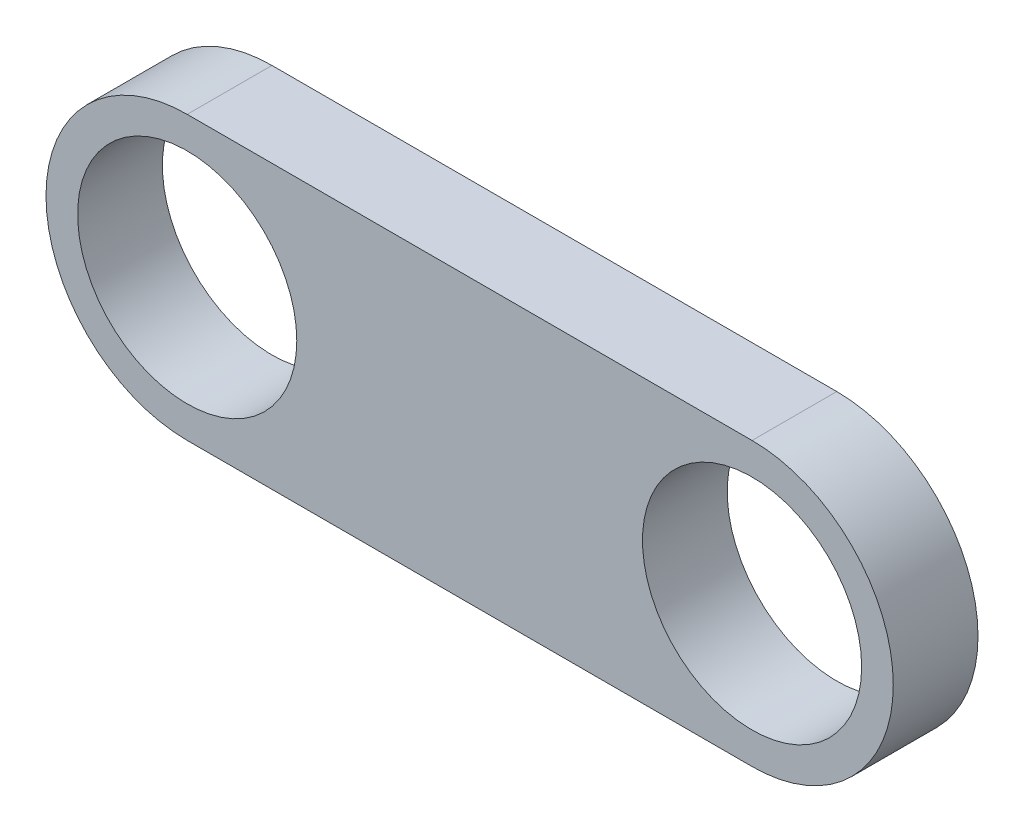
from build123d import *

# Parameters (mm, degrees)
SKETCH1_R           = 3.88
BOSS_EXTRUDE1_DEPTH = 3


with BuildPart() as part:
    # Sketch1 → Boss-Extrude1 (new body)
    with BuildSketch(Plane.XY):
        with BuildLine():
            Line((-12.201965406, -4.894629499), (7.798034594, -4.894629499))
            ThreePointArc((7.798034594, -4.894629499), (12.798034594, 0.105370501), (7.798034594, 5.105370501))
            Line((7.798034594, 5.105370501), (-12.201965406, 5.105370501))
            ThreePointArc((-12.201965406, 5.105370501), (-17.201965406, 0.105370501), (-12.201965406, -4.894629499))
        make_face()
        with Locations((-12.201965406, 0.105370501)):
            Circle(SKETCH1_R, mode=Mode.SUBTRACT)
        with Locations((7.798034594, 0.105370501)):
            Circle(SKETCH1_R, mode=Mode.SUBTRACT)
    extrude(amount=BOSS_EXTRUDE1_DEPTH)


solid = part.part
